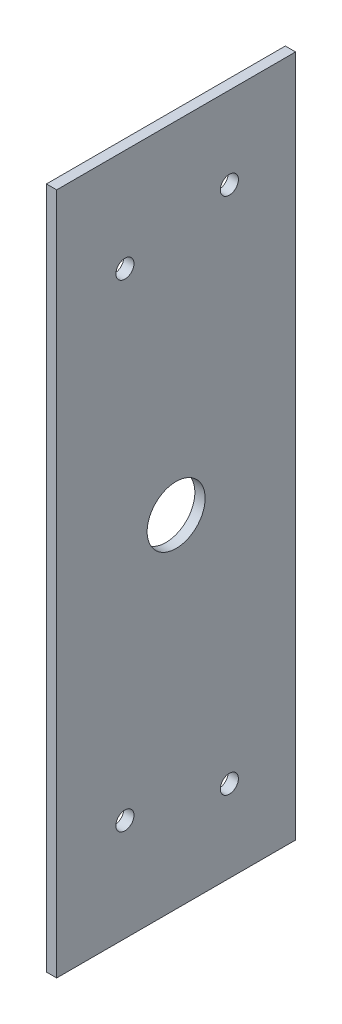
from build123d import *

# Parameters (mm, degrees)
SKETCH1_W           = 200
SKETCH1_H           = 70
SKETCH1_R           = 8.5
SKETCH1_R_2         = 2.65
BOSS_EXTRUDE1_DEPTH = 3


with BuildPart() as part:
    # Sketch1 → Boss-Extrude1 (new body)
    with BuildSketch(Plane.YZ):
        Rectangle(SKETCH1_W, SKETCH1_H)
        with Locations(Location((0, 0, 0), (0, 0, 270))):
            Circle(SKETCH1_R, mode=Mode.SUBTRACT)
        with Locations(Location((-76, -15.6, 0), (0, 0, 270))):
            Circle(SKETCH1_R_2, mode=Mode.SUBTRACT)
        with Locations(Location((76, -15.6, 0), (0, 0, 90))):
            Circle(SKETCH1_R_2, mode=Mode.SUBTRACT)
        with Locations(Location((-70, 15, 0), (0, 0, 270))):
            Circle(SKETCH1_R_2, mode=Mode.SUBTRACT)
        with Locations(Location((70, 15, 0), (0, 0, 90))):
            Circle(SKETCH1_R_2, mode=Mode.SUBTRACT)
    extrude(amount=BOSS_EXTRUDE1_DEPTH)


solid = part.part
